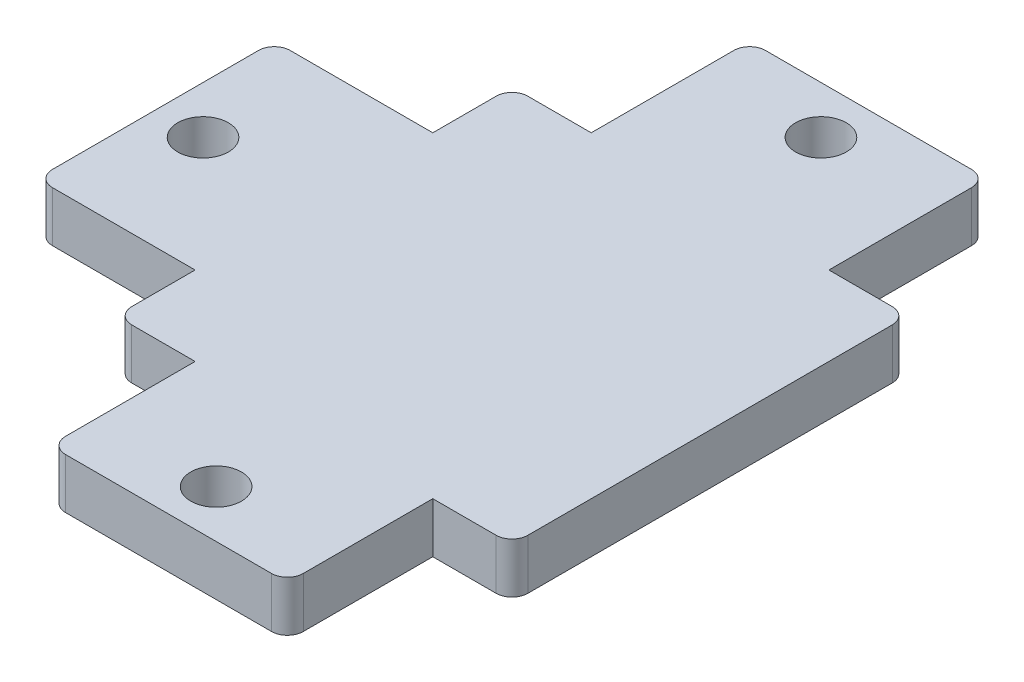
from build123d import *

# Parameters (mm, degrees)
SKETCH1_W           = 40
SKETCH1_H           = 40
BOSS_EXTRUDE1_DEPTH = 3.175
SKETCH3_W           = 15
SKETCH3_H           = 10
SKETCH3_W_2         = 10
CUT_EXTRUDE2_DEPTH  = 10
SKETCH4_R           = 1.6
CUT_EXTRUDE3_DEPTH  = 29.461915343
SKETCH5_W           = 10
SKETCH5_H           = 5
CUT_EXTRUDE4_DEPTH  = 10
SKETCH7_R           = 1.6
CUT_EXTRUDE6_DEPTH  = 10
SKETCH8_W           = 15
SKETCH8_H           = 34.175
BOSS_EXTRUDE2_DEPTH = 3.175
SKETCH9_R           = 1.6
CUT_EXTRUDE7_DEPTH  = 32.535872431
SKETCH10_W          = 5
SKETCH10_H          = 25
CUT_EXTRUDE8_DEPTH  = 10
FILLET1_R           = 1


with BuildPart() as part:
    # Sketch1 → Boss-Extrude1 (new body)
    with BuildSketch(Plane(origin=(0, 0, 0), x_dir=(1, 0, 0), z_dir=(0, 1, 0))):
        Rectangle(SKETCH1_W, SKETCH1_H)
    extrude(amount=BOSS_EXTRUDE1_DEPTH)

    # Sketch3 → Cut-Extrude2 (cut)
    with BuildSketch(Plane(origin=(0, 3.175, 0), x_dir=(1, 0, 0), z_dir=(0, 1, 0))):
        with Locations((-12.5, 15)):
            Rectangle(SKETCH3_W, SKETCH3_H)
        with Locations((15, 15)):
            Rectangle(SKETCH3_W_2, SKETCH3_H)
    extrude(amount=-CUT_EXTRUDE2_DEPTH, mode=Mode.SUBTRACT)

    # Sketch4 → Cut-Extrude3 (cut, through all)
    with BuildSketch(Plane(origin=(0, 3.175, 0), x_dir=(1, 0, 0), z_dir=(0, 1, 0))):
        with Locations(Location((2.5, 17, 0), (0, 0, 270))):
            Circle(SKETCH4_R)
    extrude(amount=-CUT_EXTRUDE3_DEPTH, mode=Mode.SUBTRACT)

    # Sketch5 → Cut-Extrude4 (cut)
    with BuildSketch(Plane(origin=(0, 3.175, 0), x_dir=(1, 0, 0), z_dir=(0, 1, 0))):
        with Locations((-15, 7.5)):
            Rectangle(SKETCH5_W, SKETCH5_H)
        Polygon((-10, -20), (-20, -20), (-20, -10), (-10, -10), (-10, -15), (20, -15), (20, -20), align=None)
    extrude(amount=-CUT_EXTRUDE4_DEPTH, mode=Mode.SUBTRACT)

    # Sketch7 → Cut-Extrude6 (cut)
    with BuildSketch(Plane(origin=(0, 3.175, 0), x_dir=(1, 0, 0), z_dir=(0, 1, 0))):
        with Locations(Location((-17, -2.5, 0), (0, 0, 270))):
            Circle(SKETCH7_R)
    extrude(amount=-CUT_EXTRUDE6_DEPTH, mode=Mode.SUBTRACT)

    # Sketch8 → Boss-Extrude2 (add)
    with BuildSketch(Plane(origin=(0, 3.175, 0), x_dir=(1, 0, 0), z_dir=(0, 1, 0))):
        with Locations((2.5, -7.0875)):
            Rectangle(SKETCH8_W, SKETCH8_H)
    extrude(amount=-BOSS_EXTRUDE2_DEPTH)

    # Sketch9 → Cut-Extrude7 (cut, through all)
    with BuildSketch(Plane(origin=(0, 3.175, 0), x_dir=(1, 0, 0), z_dir=(0, 1, 0))):
        with Locations(Location((2.5, -21.175, 0), (0, 0, 270))):
            Circle(SKETCH9_R)
    extrude(amount=-CUT_EXTRUDE7_DEPTH, mode=Mode.SUBTRACT)

    # Sketch10 → Cut-Extrude8 (cut)
    with BuildSketch(Plane(origin=(0, 3.175, 0), x_dir=(1, 0, 0), z_dir=(0, 1, 0))):
        with Locations((17.5, -2.5)):
            Rectangle(SKETCH10_W, SKETCH10_H)
    extrude(amount=-CUT_EXTRUDE8_DEPTH, mode=Mode.SUBTRACT)

    # Fillet1
    fillet1_edges = [part.edges().sort_by_distance(p)[0] for p in [
        (-5, 1.5875, 24.175),
        (10, 1.5875, 24.175),
        (15, 1.5875, 15),
        (15, 1.5875, -10),
        (-5, 1.5875, -20),
        (10, 1.5875, -20),
        (-10, 1.5875, -10),
        (-20, 1.5875, -5),
        (-20, 1.5875, 10),
        (-10, 1.5875, 15),
    ]]
    fillet(fillet1_edges, radius=FILLET1_R)


solid = part.part
